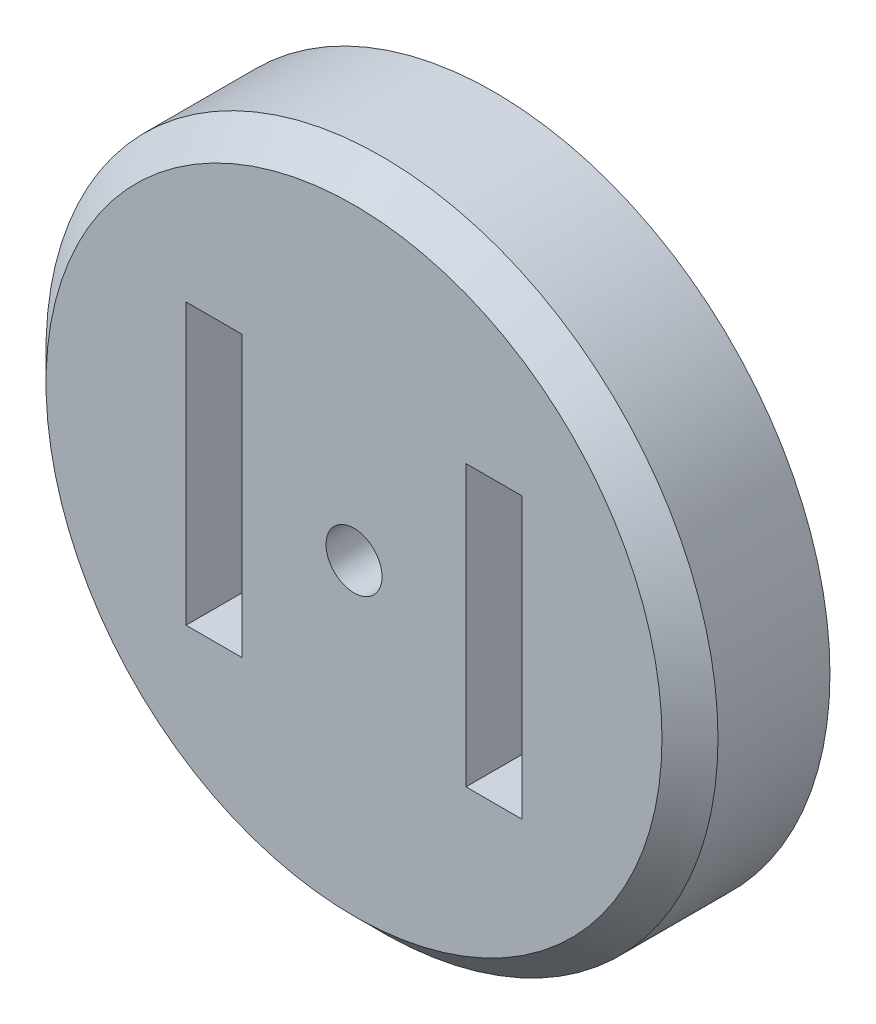
from build123d import *

# Parameters (mm, degrees)
ESQUISSE1_R                  = 60
BOSS_EXTRU_1_DEPTH           = 25
ENL_V_MAT_EXTRU_1_DEPTH      = 89.459030065
ENL_V_MAT_EXTRU_1_DEPTH_BACK = 89.459030065
ESQUISSE2_W                  = 10
ESQUISSE2_H                  = 50
CHANFREIN1_SIZE              = 5
ENL_V_MAT_EXTRU_2_DEPTH      = 89.459030065
ENL_V_MAT_EXTRU_2_DEPTH_BACK = 89.459030065
ESQUISSE3_R                  = 5
ESQUISSE4_R                  = 18
ENL_V_MAT_EXTRU_3_DEPTH      = 4


with BuildPart() as part:
    # Esquisse1 → Boss.-Extru.1 (new body)
    with BuildSketch(Plane.XY):
        Circle(ESQUISSE1_R)
    extrude(amount=BOSS_EXTRU_1_DEPTH)

    # Esquisse2 → Enlèv. mat.-Extru.1 (cut, two sides: drawn at the far end of the back side and taken through both)
    with BuildSketch(Plane.XY.offset(25).offset(-ENL_V_MAT_EXTRU_1_DEPTH_BACK)):
        with Locations((-25, 0)):
            Rectangle(ESQUISSE2_W, ESQUISSE2_H)
        with Locations((25, 0)):
            Rectangle(ESQUISSE2_W, ESQUISSE2_H)
    extrude(amount=ENL_V_MAT_EXTRU_1_DEPTH + ENL_V_MAT_EXTRU_1_DEPTH_BACK, mode=Mode.SUBTRACT)

    # Chanfrein1
    chanfrein1_edges = [part.edges().sort_by_distance(p)[0] for p in [
        (-60, 0, 25),
    ]]
    chamfer(chanfrein1_edges, length=CHANFREIN1_SIZE)

    # Esquisse3 → Enlèv. mat.-Extru.2 (cut, two sides: drawn at the far end of the back side and taken through both)
    with BuildSketch(Plane.XY.offset(25).offset(-ENL_V_MAT_EXTRU_2_DEPTH_BACK)):
        Circle(ESQUISSE3_R)
    extrude(amount=ENL_V_MAT_EXTRU_2_DEPTH + ENL_V_MAT_EXTRU_2_DEPTH_BACK, mode=Mode.SUBTRACT)

    # Esquisse4 → Enlèv. mat.-Extru.3 (cut)
    with BuildSketch(Plane(origin=(0, 0, 0), x_dir=(-1, 0, 0), z_dir=(0, 0, -1))):
        Circle(ESQUISSE4_R)
    extrude(amount=-ENL_V_MAT_EXTRU_3_DEPTH, mode=Mode.SUBTRACT)


solid = part.part
